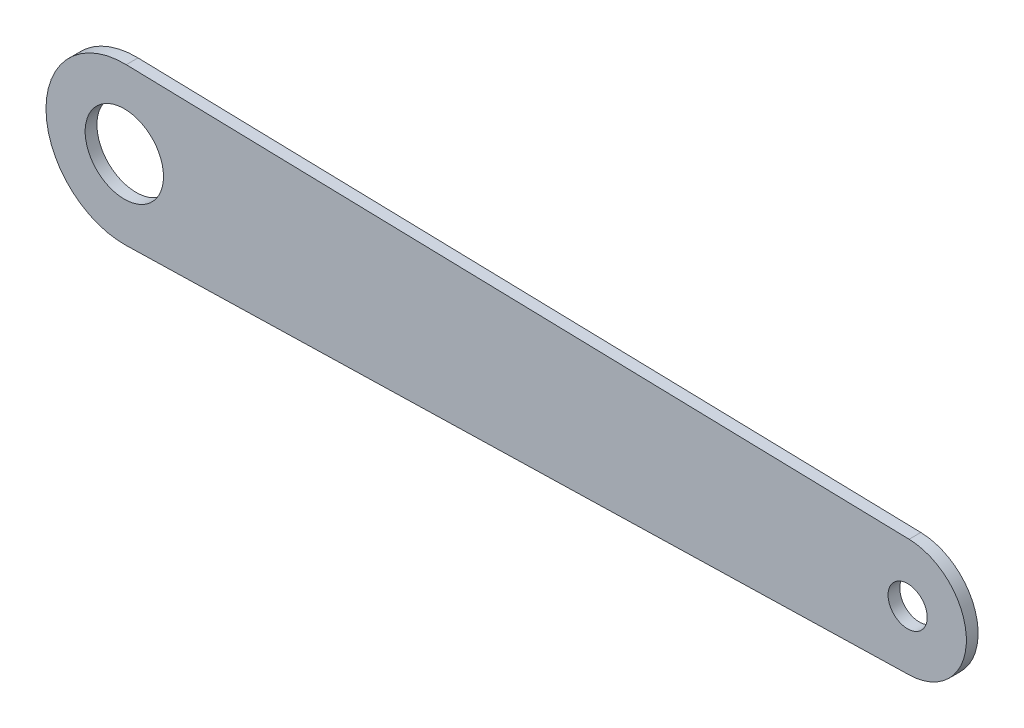
from build123d import *

# Parameters (mm, degrees)
SKETCH1_R           = 10
SKETCH1_R_2         = 5
BOSS_EXTRUDE1_DEPTH = 3


with BuildPart() as part:
    # Sketch1 → Boss-Extrude1 (new body)
    with BuildSketch(Plane.XY):
        with BuildLine():
            Line((0.5, 19.993749023), (200.375, 14.995311767))
            ThreePointArc((200.375, 14.995311767), (215, 0), (200.375, -14.995311767))
            Line((200.375, -14.995311767), (0.5, -19.993749023))
            ThreePointArc((0.5, -19.993749023), (-20, 0), (0.5, 19.993749023))
        make_face()
        Circle(SKETCH1_R, mode=Mode.SUBTRACT)
        with Locations((200, 0)):
            Circle(SKETCH1_R_2, mode=Mode.SUBTRACT)
    extrude(amount=BOSS_EXTRUDE1_DEPTH)


solid = part.part
